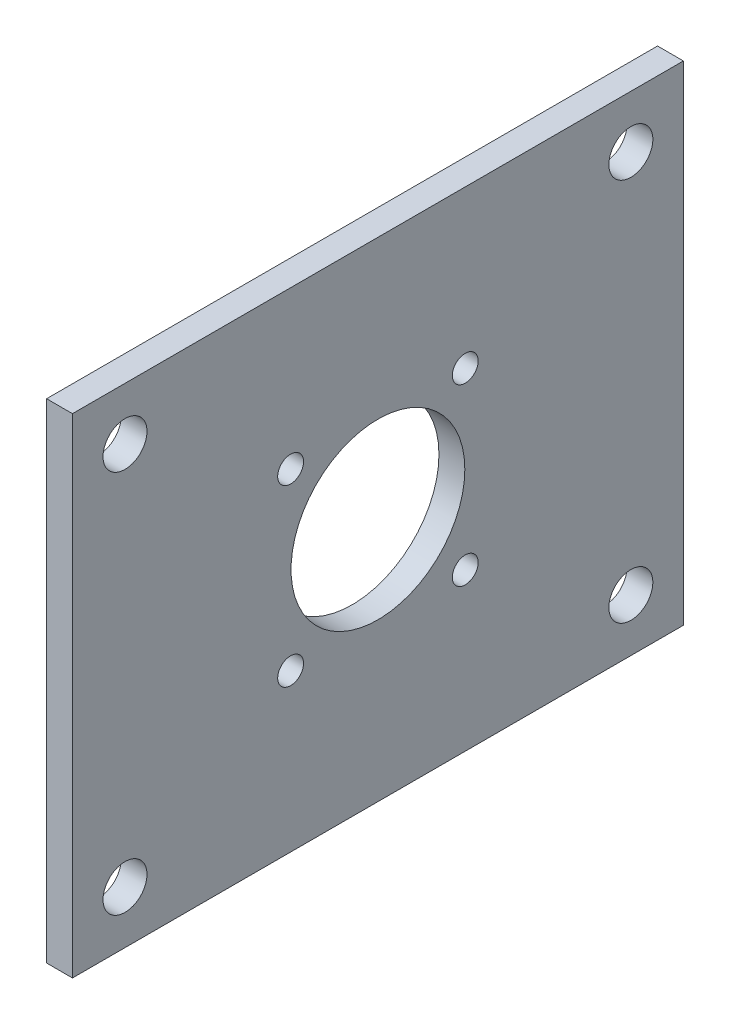
from build123d import *

# Parameters (mm, degrees)
BOSS_EXTRUDE1_DEPTH      = 1.5875
BOSS_EXTRUDE1_DEPTH_BACK = 1.5875
SKETCH1_W                = 75
SKETCH1_H                = 60
CUT_EXTRUDE1_DEPTH       = 49.049663435
CUT_EXTRUDE1_DEPTH_BACK  = 49.049663435
SKETCH2_R                = 2.7
CUT_EXTRUDE2_DEPTH       = 49.049663435
CUT_EXTRUDE2_DEPTH_BACK  = 49.049663435
SKETCH3_R                = 10.668
SKETCH3_R_2              = 1.5875


with BuildPart() as part:
    # Sketch1 → Boss-Extrude1 (new, two sides: drawn at the far end of the back side and taken through both)
    with BuildSketch(Plane(origin=(0, 0, 0), x_dir=(0, 0, -1), z_dir=(1, 0, 0)).offset(-BOSS_EXTRUDE1_DEPTH_BACK)):
        Rectangle(SKETCH1_W, SKETCH1_H)
    extrude(amount=BOSS_EXTRUDE1_DEPTH + BOSS_EXTRUDE1_DEPTH_BACK)

    # Sketch2 → Cut-Extrude1 (cut, two sides: drawn at the far end of the back side and taken through both)
    with BuildSketch(Plane(origin=(0, 0, 0), x_dir=(0, 0, -1), z_dir=(1, 0, 0)).offset(-CUT_EXTRUDE1_DEPTH_BACK)):
        with Locations((-31.05, 23.55)):
            Circle(SKETCH2_R)
        with Locations((31.05, 23.55)):
            Circle(SKETCH2_R)
        with Locations((31.05, -23.55)):
            Circle(SKETCH2_R)
        with Locations((-31.05, -23.55)):
            Circle(SKETCH2_R)
    extrude(amount=CUT_EXTRUDE1_DEPTH + CUT_EXTRUDE1_DEPTH_BACK, mode=Mode.SUBTRACT)

    # Sketch3 → Cut-Extrude2 (cut, two sides: drawn at the far end of the back side and taken through both)
    with BuildSketch(Plane(origin=(0, 0, 0), x_dir=(0, 0, -1), z_dir=(1, 0, 0)).offset(-CUT_EXTRUDE2_DEPTH_BACK)):
        Circle(SKETCH3_R)
        with Locations((-10.7188, 10.7188)):
            Circle(SKETCH3_R_2)
        with Locations((10.7188, 10.7188)):
            Circle(SKETCH3_R_2)
        with Locations((10.7188, -10.7188)):
            Circle(SKETCH3_R_2)
        with Locations((-10.7188, -10.7188)):
            Circle(SKETCH3_R_2)
    extrude(amount=CUT_EXTRUDE2_DEPTH + CUT_EXTRUDE2_DEPTH_BACK, mode=Mode.SUBTRACT)


solid = part.part
